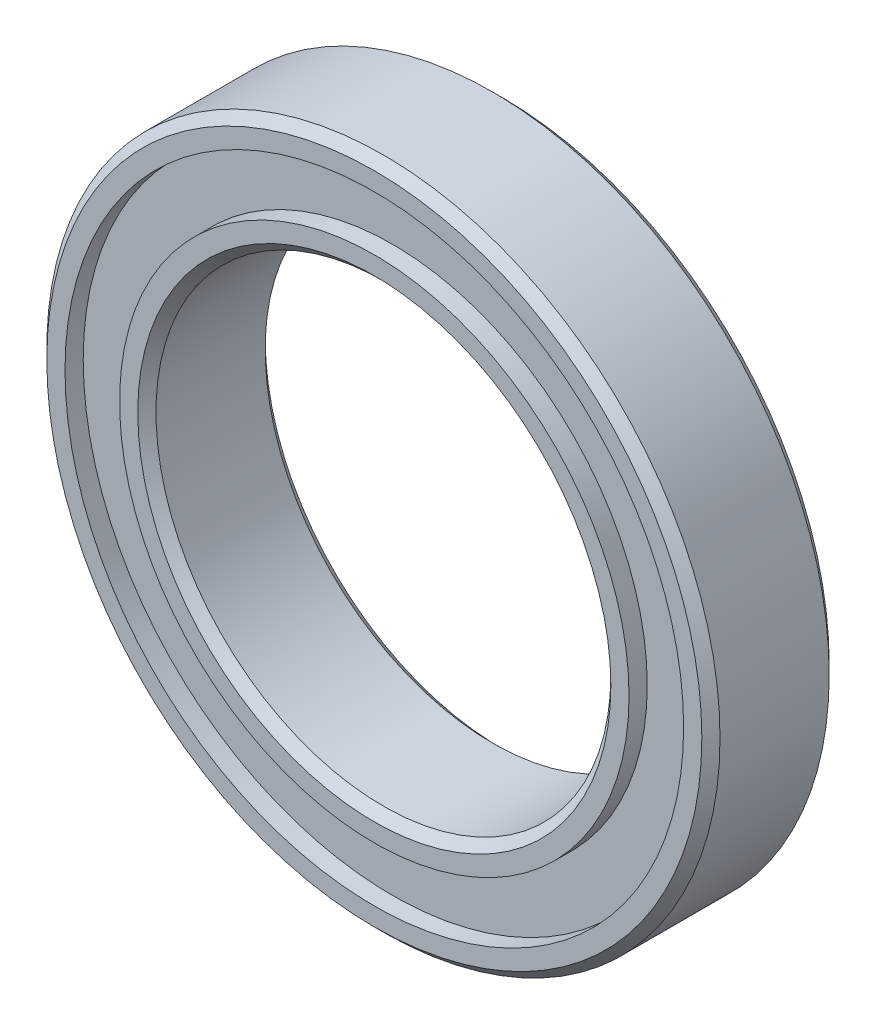
from build123d import *

# Parameters (mm, degrees)
AUFSATZ_LINEAR_AUSTRAGEN1_DEPTH      = 3.5
AUFSATZ_LINEAR_AUSTRAGEN1_DEPTH_BACK = 3.5
SKIZZE1_R                            = 18.5
SKIZZE1_R_2                          = 12.5
SKIZZE2_R                            = 17
SKIZZE2_R_2                          = 14
SCHNITT_LINEAR_AUSTRAGEN1_DEPTH      = 1
FASE1_SIZE                           = 0.5


with BuildPart() as part:
    # Skizze1 → Aufsatz-Linear austragen1 (new, two sides: drawn at the far end of the back side and taken through both)
    with BuildSketch(Plane.XY.offset(-AUFSATZ_LINEAR_AUSTRAGEN1_DEPTH_BACK)):
        Circle(SKIZZE1_R)
        Circle(SKIZZE1_R_2, mode=Mode.SUBTRACT)
    extrude(amount=AUFSATZ_LINEAR_AUSTRAGEN1_DEPTH + AUFSATZ_LINEAR_AUSTRAGEN1_DEPTH_BACK)

    # Skizze2 → Schnitt-Linear austragen1 (cut)
    with BuildSketch(Plane.XY.offset(3.5)):
        Circle(SKIZZE2_R)
        Circle(SKIZZE2_R_2, mode=Mode.SUBTRACT)
    schnitt_linear_austragen1 = extrude(amount=-SCHNITT_LINEAR_AUSTRAGEN1_DEPTH, mode=Mode.SUBTRACT)

    # Spiegeln1: Schnitt-Linear austragen1 across plane
    add(schnitt_linear_austragen1.mirror(Plane.XY), mode=Mode.SUBTRACT)

    # Fase1
    fase1_edges = [part.edges().sort_by_distance(p)[0] for p in [
        (-12.5, 0, 3.5),
        (-12.5, 0, -3.5),
        (-18.5, 0, 3.5),
        (-18.5, 0, -3.5),
    ]]
    chamfer(fase1_edges, length=FASE1_SIZE)


solid = part.part
